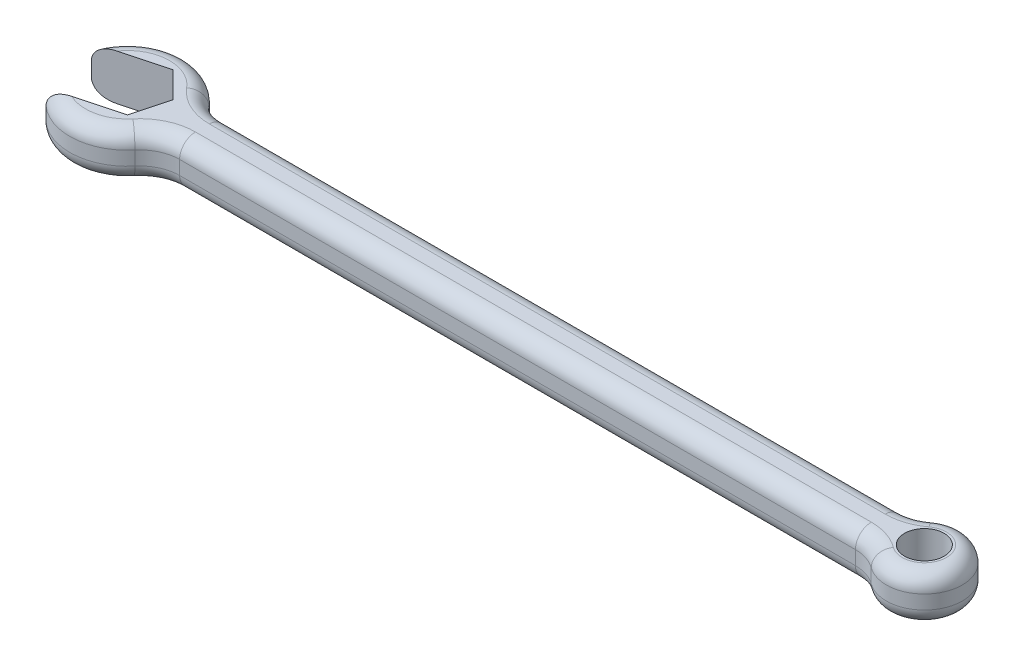
from build123d import *

# Parameters (mm, degrees)
SKETCH1_R           = 10.000000000000009
BOSS_EXTRUDE1_DEPTH = 23
FILLET1_R           = 20
FILLET2_R           = 8


with BuildPart() as part:
    # Sketch1 → Boss-Extrude1 (new body)
    # profile 1 of 8: a face of its own
    with BuildSketch(Plane(origin=(0, 0, 0), x_dir=(1, 0, 0), z_dir=(0, 1, 0))):
        with BuildLine():
            Line((190.53750510204208, 11.499999999999996), (-169.0643228571688, 11.499999999999996))
            ThreePointArc((-169.06432285716886, 11.499999999999785), (-167.29719813473903, 5.8702645292353655), (-166.699999999998, -5.84695e-12))
            ThreePointArc((-166.699999999998, -5.85409e-12), (-167.29719813473773, -5.870264529240628), (-169.0643228571637, -11.499999999999407))
            Line((-169.0643228571635, -11.499999999999996), (190.53750510204208, -11.499999999999996))
            ThreePointArc((190.53750510204202, -11.500000000000126), (186.70000000000027, 2.35e-15), (190.53750510204205, 11.500000000000131))
        make_face()
    # profile 2 of 8: a face of its own
    with BuildSketch(Plane(origin=(0, 0, 0), x_dir=(1, 0, 0), z_dir=(0, 1, 0))):
        with BuildLine():
            Line((-209.0364197819809, 13.186419781973054), (-191.02343537482668, 18.01298440714431))
            Line((-191.02343537482668, 18.01298440714431), (-184.51045096768246, 11.499999999999996))
            Line((-184.51045096768246, 11.499999999999996), (-169.0643228571688, 11.499999999999996))
            ThreePointArc((-169.06432285716886, 11.499999999999785), (-195.8499999999993, 29.149999999995877), (-222.63567714283025, 11.500000000000531))
            Line((-222.63567714283008, 11.499999999999996), (-215.33022409119366, 11.499999999999996))
            Line((-215.33022409119366, 11.500000000000018), (-209.0364197819809, 13.186419781973054))
        make_face()
    # profile 3 of 8: a face of its own
    with BuildSketch(Plane(origin=(0, 0, 0), x_dir=(1, 0, 0), z_dir=(0, 1, 0))):
        with BuildLine():
            Line((-169.0643228571688, 11.499999999999996), (-184.51045096768246, 11.499999999999996))
            Line((-184.51045096768246, 11.499999999999996), (-177.83701559284398, 4.826564625161424))
            Line((-177.83701559284398, 4.826564625161426), (-182.21170539933064, -11.499999999999996))
            Line((-182.21170539933064, -11.499999999999996), (-169.0643228571635, -11.499999999999996))
            ThreePointArc((-169.0643228571637, -11.499999999999407), (-167.29719813473773, -5.870264529240628), (-166.699999999998, -5.85409e-12))
            ThreePointArc((-166.699999999998, -5.84695e-12), (-167.29719813473903, 5.8702645292353655), (-169.06432285716886, 11.499999999999785))
        make_face()
    # profile 4 of 8: a face of its own
    with BuildSketch(Plane(origin=(0, 0, 0), x_dir=(1, 0, 0), z_dir=(0, 1, 0))):
        with BuildLine():
            Line((-169.0643228571635, -11.499999999999996), (-182.21170539933064, -11.499999999999996))
            Line((-182.21170539933064, -11.499999999999996), (-182.66358021801545, -13.186419781992653))
            Line((-182.66358021801545, -13.186419781992653), (-200.67656462516962, -18.012984407163884))
            Line((-200.67656462516962, -18.012984407163888), (-215.11044742166933, -21.880531646131363))
            ThreePointArc((-215.11044742167047, -21.88053164613265), (-189.43937367309758, -28.43635648421335), (-169.0643228571637, -11.499999999999407))
        make_face()
    # profile 5 of 8: a face of its own
    with BuildSketch(Plane(origin=(0, 0, 0), x_dir=(1, 0, 0), z_dir=(0, 1, 0))):
        with BuildLine():
            Line((221.162494897959, 11.499999999999996), (190.53750510204208, 11.499999999999996))
            ThreePointArc((190.53750510204205, 11.500000000000131), (186.70000000000027, 2.35e-15), (190.53750510204202, -11.500000000000126))
            Line((190.53750510204208, -11.499999999999996), (221.162494897959, -11.499999999999996))
            ThreePointArc((221.16249489795885, -11.499999999999684), (224.0153072819582, -6.061692119536153), (225.00000000000028, -4.69e-15))
            ThreePointArc((225.00000000000028, 0), (224.0153072819582, 6.061692119536143), (221.16249489795888, 11.49999999999967))
        make_face()
        with Locations(Location((205.85000000000028, 0, 0), (0, 0, 270))):
            Circle(SKETCH1_R, mode=Mode.SUBTRACT)
    # profile 6 of 8: a face of its own
    with BuildSketch(Plane(origin=(0, 0, 0), x_dir=(1, 0, 0), z_dir=(0, 1, 0))):
        with BuildLine():
            Line((221.162494897959, -11.499999999999996), (190.53750510204208, -11.499999999999996))
            ThreePointArc((190.53750510204202, -11.500000000000126), (205.85000000000053, -19.150000000000006), (221.16249489795885, -11.499999999999684))
        make_face()
    # profile 7 of 8: a face of its own
    with BuildSketch(Plane(origin=(0, 0, 0), x_dir=(1, 0, 0), z_dir=(0, 1, 0))):
        with BuildLine():
            ThreePointArc((221.16249489795888, 11.49999999999967), (205.85000000000056, 19.150000000000006), (190.53750510204205, 11.500000000000131))
            Line((190.53750510204208, 11.499999999999996), (221.162494897959, 11.499999999999996))
        make_face()
    # profile 8 of 8: a face of its own
    with BuildSketch(Plane(origin=(0, 0, 0), x_dir=(1, 0, 0), z_dir=(0, 1, 0))):
        with BuildLine():
            Line((-223.47030257848598, 9.31887254300414), (-215.33022409119366, 11.500000000000018))
            Line((-215.33022409119366, 11.499999999999996), (-222.63567714283008, 11.499999999999996))
            ThreePointArc((-222.63567714283025, 11.500000000000519), (-223.0748413513289, 10.417797914863556), (-223.4703025784876, 9.318872543004696))
        make_face()
    extrude(amount=BOSS_EXTRUDE1_DEPTH)

    # Fillet1
    fillet1_edges = [part.edges().sort_by_distance(p)[0] for p in [
        (-169.06432285716357, 11.5, 11.499999999999702),
        (-169.06432285716883, 11.5, -11.499999999999892),
        (190.53750510204208, 11.5, -11.500000000000068),
        (190.53750510204205, 11.5, 11.500000000000059),
    ]]
    fillet(fillet1_edges, radius=FILLET1_R)

    # Fillet2
    fillet2_edges = [part.edges().sort_by_distance(p)[0] for p in [
        (-193.61734753029688, 0, 29.06437274310201),
        (225.00000000000028, 0, -2.576e-14),
        (225.0000000000003, 23, -4.174e-14),
        (12.240435042127586, 0, 11.499999999999766),
        (12.240435042127586, 23, 11.499999999999766),
        (12.24043504212267, 0, -11.499999999999865),
        (12.240435042122641, 23, -11.499999999999865),
        (-201.21583651826683, 0, -28.651881237695218),
        (-201.21583651826677, 23, -28.651881237695314),
        (188.85337218093906, 0, 12.50211748036416),
        (-193.61734753029688, 23, 29.06437274310201),
        (188.85337218093903, 23, 12.502117480364152),
        (188.85337218093898, 0, -12.502117480364163),
        (188.85337218093898, 23, -12.502117480364163),
        (-166.59579003361372, 0, -13.384287379634728),
        (-166.59579003361372, 23, -13.384287379634728),
        (-166.5957900336068, 0, 13.384287379636046),
        (-166.5957900336068, 23, 13.384287379636042),
    ]]
    fillet(fillet2_edges, radius=FILLET2_R)


solid = part.part
